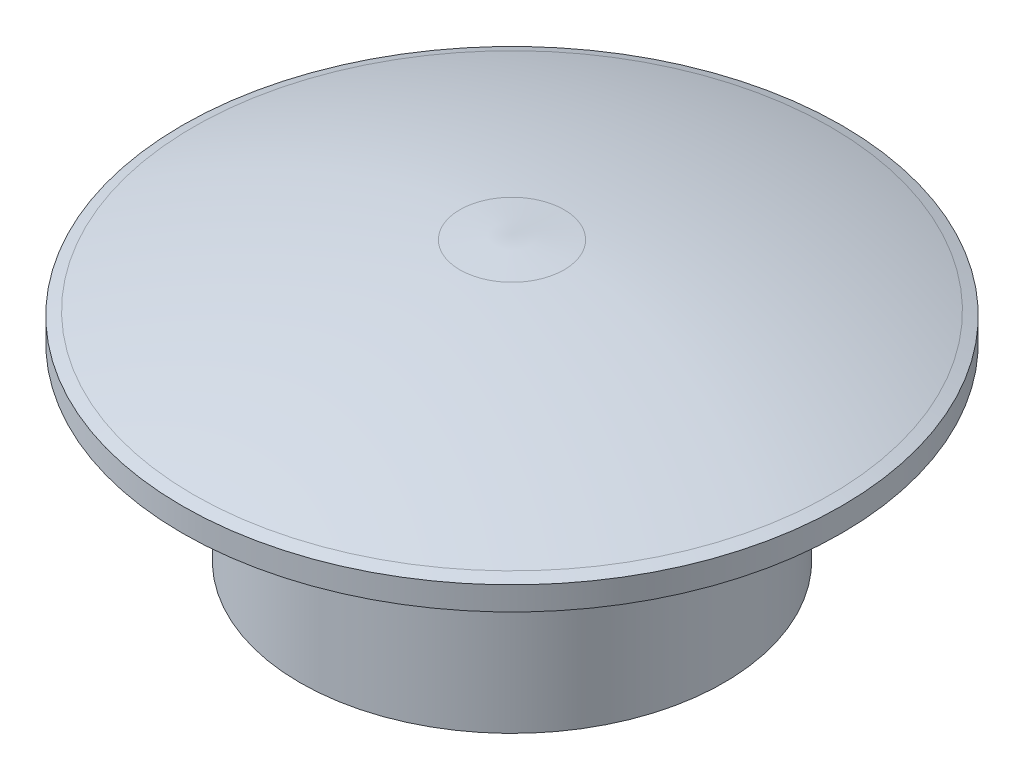
from build123d import *

# Parameters (mm, degrees)
FILLET1_R = 22
SHELL1_T  = -0.25


with BuildPart() as part:
    # Sketch1 → Revolve3 (revolve)
    with BuildSketch(Plane.XY, mode=Mode.PRIVATE) as revolve3_sk:
        Polygon((0, 0), (4.5, 0), (4.5, 4), (7, 4), (7, 4.5), (4.021373221, 5.618538642), (0, 6), align=None)
    revolve(revolve3_sk.sketch.rotate(Axis((0, 6, 0), (0, -1, 0)), 90), axis=Axis((0, 6, 0), (0, -1, 0)))

    # Fillet1
    fillet1_edges = [part.edges().sort_by_distance(p)[0] for p in [
        (0, 5.618538642, -4.021373221),
    ]]
    fillet(fillet1_edges, radius=FILLET1_R)

    # Shell1
    shell1_openings = [part.faces().sort_by_distance(p)[0] for p in [
        (0, 0, 0),
    ]]
    offset(amount=SHELL1_T, openings=shell1_openings, kind=Kind.INTERSECTION)


solid = part.part
